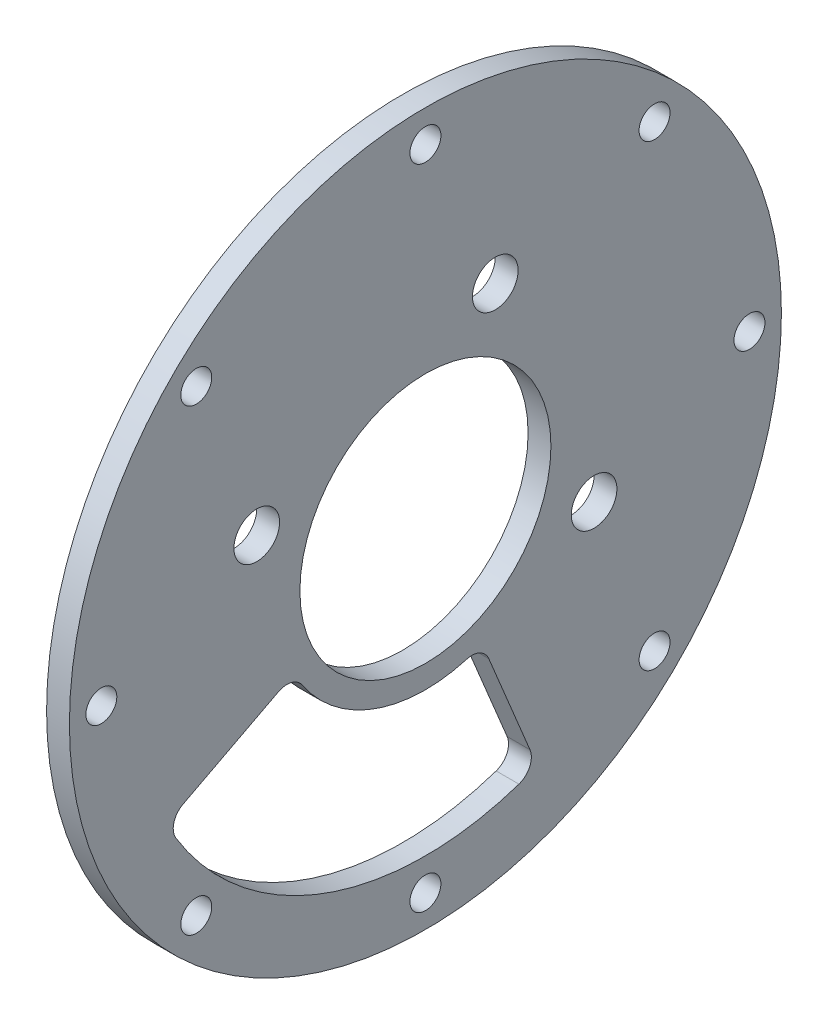
from build123d import *

# Parameters (mm, degrees)
SKETCH1_R           = 49.53
SKETCH1_R_2         = 2.15265
SKETCH1_R_3         = 17.4625
SKETCH1_R_4         = 3.175
BOSS_EXTRUDE1_DEPTH = 3.175
CUT_EXTRUDE1_DEPTH  = 71.117918002


with BuildPart() as part:
    # Sketch1 → Boss-Extrude1 (new body)
    with BuildSketch(Plane(origin=(0, 0, 0), x_dir=(0, 0, -1), z_dir=(1, 0, 0))):
        Circle(SKETCH1_R)
        with Locations((0, 45.085)):
            Circle(SKETCH1_R_2, mode=Mode.SUBTRACT)
        with Locations((31.87990923, 31.87990923)):
            Circle(SKETCH1_R_2, mode=Mode.SUBTRACT)
        with Locations((45.085, 0)):
            Circle(SKETCH1_R_2, mode=Mode.SUBTRACT)
        with Locations((31.87990923, -31.87990923)):
            Circle(SKETCH1_R_2, mode=Mode.SUBTRACT)
        with Locations((0, -45.085)):
            Circle(SKETCH1_R_2, mode=Mode.SUBTRACT)
        with Locations((-31.87990923, -31.87990923)):
            Circle(SKETCH1_R_2, mode=Mode.SUBTRACT)
        with Locations((-45.085, 0)):
            Circle(SKETCH1_R_2, mode=Mode.SUBTRACT)
        with Locations((-31.87990923, 31.87990923)):
            Circle(SKETCH1_R_2, mode=Mode.SUBTRACT)
        Circle(SKETCH1_R_3, mode=Mode.SUBTRACT)
        with Locations((9.720159182, 23.466540126)):
            Circle(SKETCH1_R_4, mode=Mode.SUBTRACT)
        with Locations((23.466540126, -9.720159182)):
            Circle(SKETCH1_R_4, mode=Mode.SUBTRACT)
        with Locations((-9.720159182, -23.466540126)):
            Circle(SKETCH1_R_4, mode=Mode.SUBTRACT)
        with Locations((-23.466540126, 9.720159182)):
            Circle(SKETCH1_R_4, mode=Mode.SUBTRACT)
    extrude(amount=BOSS_EXTRUDE1_DEPTH)

    # Sketch2 → Cut-Extrude1 (cut, through all)
    with BuildSketch(Plane(origin=(3.175, 0, 0), x_dir=(0, 0, -1), z_dir=(1, 0, 0))):
        with BuildLine():
            Line((-20.434868218, -10.637719077), (-33.719928863, -17.553483913))
            ThreePointArc((-33.719928863, -17.553483913), (-34.993654696, -19.123916601), (-34.716893211, -21.126924191))
            ThreePointArc((-34.716893211, -21.126924191), (-13.899698625, -38.189108109), (13.014558026, -38.49975168))
            ThreePointArc((13.014558026, -38.49975168), (14.514078084, -37.143257699), (14.547802162, -35.121501281))
            Line((14.547802162, -35.121501281), (8.816223227, -21.284245682))
            ThreePointArc((8.816223227, -21.284245682), (7.568898247, -19.966485263), (5.760575328, -19.817219233))
            ThreePointArc((5.760575328, -19.817219233), (-7.058440708, -19.392906461), (-17.1511197, -11.478044227))
            ThreePointArc((-17.1511197, -11.478044227), (-18.632321778, -10.430021072), (-20.434868218, -10.637719077))
        make_face()
    extrude(amount=-CUT_EXTRUDE1_DEPTH, mode=Mode.SUBTRACT)


solid = part.part
